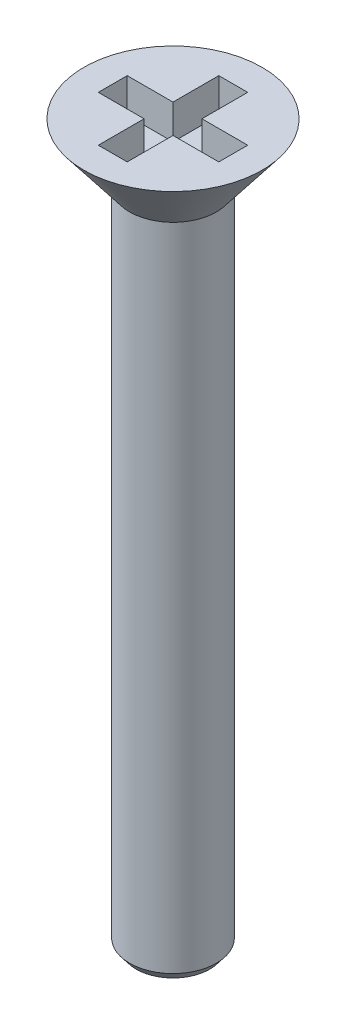
from build123d import *

# Parameters (mm, degrees)
CUT_EXTRUDE1_DEPTH = 1.43


with BuildPart() as part:
    # Sketch1 → Revolve1 (revolve)
    with BuildSketch(Plane(origin=(0, 0, 0), x_dir=(0, 0, -1), z_dir=(1, 0, 0))):
        Polygon((0, 11.789679649), (-3.7, 11.789679649), (-1.8, 9.339679649), (-1.8, -17.660320351), (-1.528571429, -18.010320351), (0, -18.010320351), align=None)
    revolve(axis=Axis((0, 14.440515102, 0), (0, -1, 0)))

    # Sketch2 → Cut-Extrude1 (cut)
    with BuildSketch(Plane(origin=(0, 11.789679649, 0), x_dir=(1, 0, 0), z_dir=(0, 1, 0))):
        Polygon((2.5, -0.6), (0.6, -0.6), (0.6, -2.5), (-0.6, -2.5), (-0.6, -0.6), (-2.5, -0.6), (-2.5, 0.6), (-0.6, 0.6), (-0.6, 2.5), (0.6, 2.5), (0.6, 0.6), (2.5, 0.6), align=None)
    extrude(amount=-CUT_EXTRUDE1_DEPTH, mode=Mode.SUBTRACT)


solid = part.part
